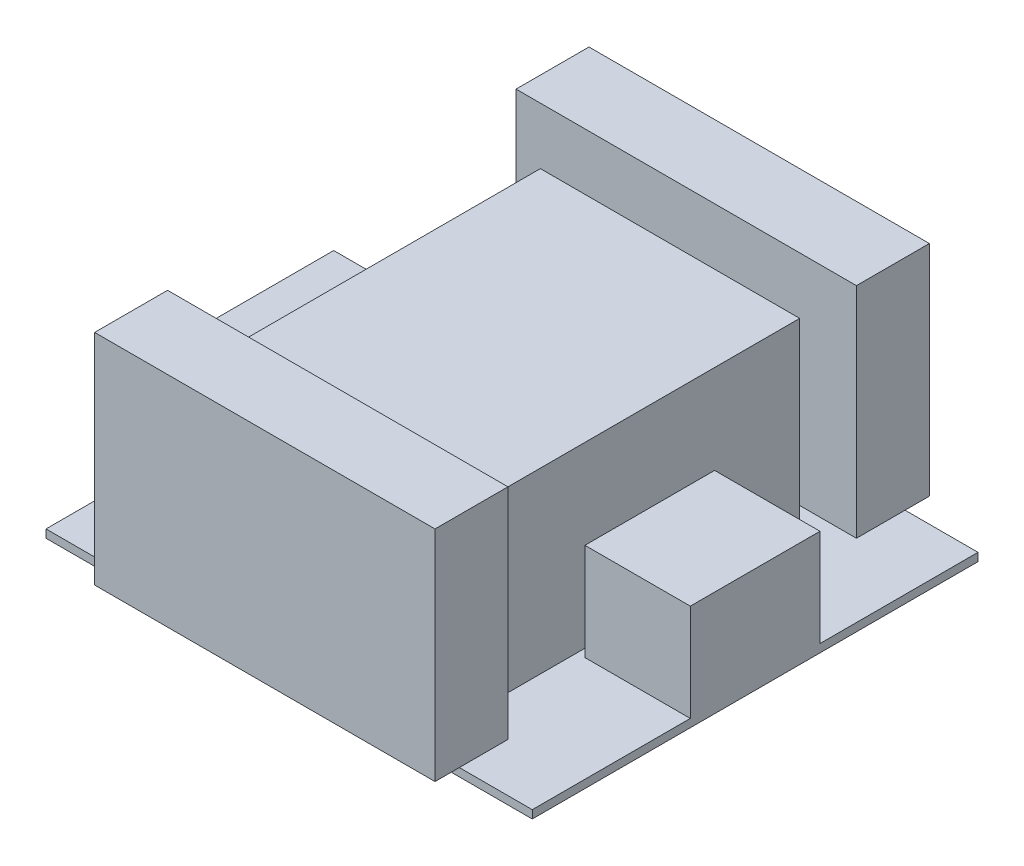
from build123d import *

# Parameters (mm, degrees)
SKETCH1_W           = 60
SKETCH1_H           = 55
BOSS_EXTRUDE1_DEPTH = 1
SKETCH2_W           = 42
SKETCH2_H           = 9
BOSS_EXTRUDE2_DEPTH = 27
SKETCH3_W           = 13
SKETCH3_H           = 16
BOSS_EXTRUDE3_DEPTH = 12
SKETCH4_W           = 32
SKETCH4_H           = 39
BOSS_EXTRUDE4_DEPTH = 22


with BuildPart() as part:
    # Sketch1 → Boss-Extrude1 (new body)
    with BuildSketch(Plane(origin=(0, 0, 0), x_dir=(1, 0, 0), z_dir=(0, 1, 0))):
        Rectangle(SKETCH1_W, SKETCH1_H)
    extrude(amount=BOSS_EXTRUDE1_DEPTH)

    # Sketch2 → Boss-Extrude2 (add)
    with BuildSketch(Plane(origin=(0, 1, 0), x_dir=(1, 0, 0), z_dir=(0, 1, 0))):
        with Locations((0, 26)):
            Rectangle(SKETCH2_W, SKETCH2_H)
        with Locations((0, -26)):
            Rectangle(SKETCH2_W, SKETCH2_H)
    extrude(amount=BOSS_EXTRUDE2_DEPTH)

    # Sketch3 → Boss-Extrude3 (add)
    with BuildSketch(Plane(origin=(0, 1, 0), x_dir=(1, 0, 0), z_dir=(0, 1, 0))):
        with Locations((-23.5, 0)):
            Rectangle(SKETCH3_W, SKETCH3_H)
        with Locations((23.5, 0)):
            Rectangle(SKETCH3_W, SKETCH3_H)
    extrude(amount=BOSS_EXTRUDE3_DEPTH)

    # Sketch4 → Boss-Extrude4 (add)
    with BuildSketch(Plane(origin=(0, 1, 0), x_dir=(1, 0, 0), z_dir=(0, 1, 0))):
        Rectangle(SKETCH4_W, SKETCH4_H)
    extrude(amount=BOSS_EXTRUDE4_DEPTH)


solid = part.part
